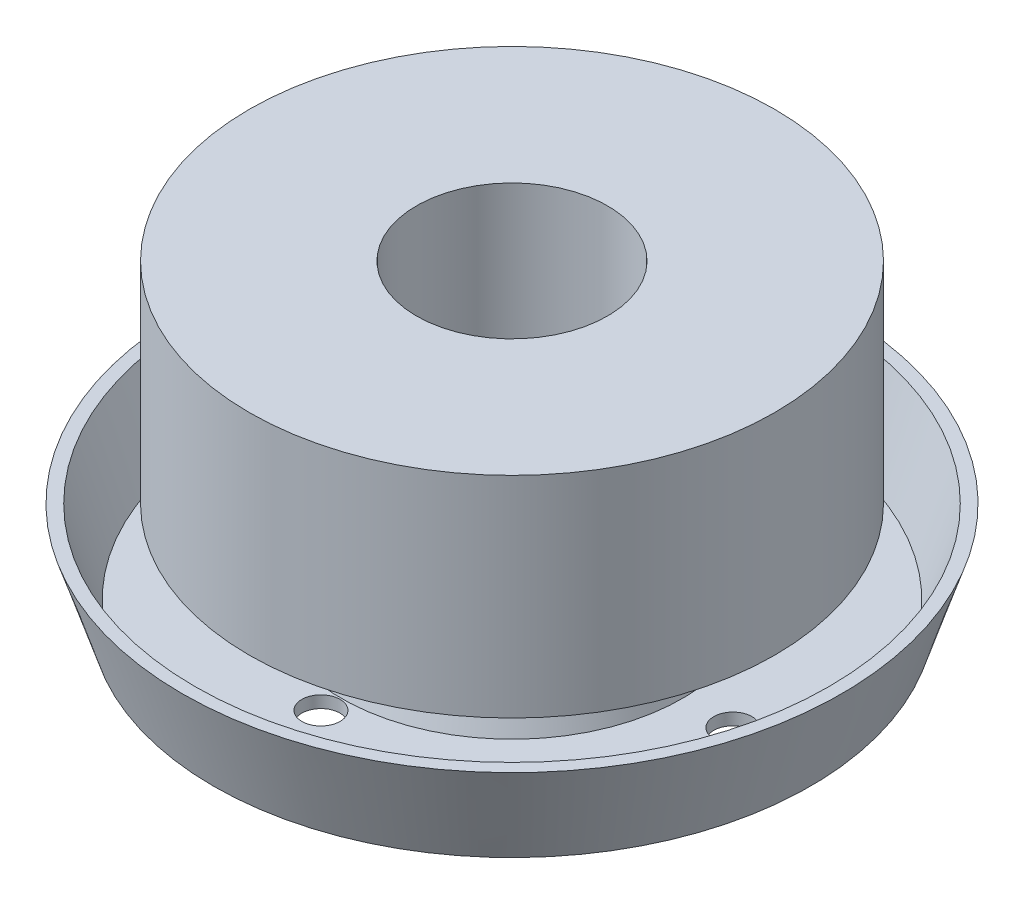
from build123d import *

# Parameters (mm, degrees)
SKETCH2_R                       = 11
SKETCH2_R_2                     = 4
BOSS_EXTRUDE1_DEPTH             = 8.8
M2X0_4_TAPPED_HOLE1_D           = 1.6
M2X0_4_TAPPED_HOLE1_DEPTH       = 0.5
BOSS_EXTRUDE3_START             = 14
BOSS_EXTRUDE3_DEPTH             = 5
BOSS_EXTRUDE3_DIRECTION_2_REACH = 39.339


with BuildPart() as part:
    # Sketch1 → Revolve1 (revolve)
    with BuildSketch(Plane.XY, mode=Mode.PRIVATE) as revolve1_sk:
        Polygon((1.5, 4), (1.5, 0), (12.5, 0), (13.8, 4), (13.274256479, 4), (12.136756479, 0.5), (7.1375, 0.5), (6, 4), align=None)
    revolve(revolve1_sk.sketch.rotate(Axis((0, 0, 0), (0, 1, 0)), 90), axis=Axis((0, 0, 0), (0, 1, 0)))

    # Sketch2 → Boss-Extrude1 (add)
    with BuildSketch(Plane(origin=(0, 4, 0), x_dir=(1, 0, 0), z_dir=(0, 1, 0))):
        with Locations(Location((0, 0, 0), (0, 0, 270))):
            Circle(SKETCH2_R)
        with Locations(Location((0, 0, 0), (0, 0, 270))):
            Circle(SKETCH2_R_2, mode=Mode.SUBTRACT)
    extrude(amount=BOSS_EXTRUDE1_DEPTH)

    # M2x0.4 Tapped Hole1
    with Locations(Plane(origin=(0, 0, 0), x_dir=(-1, 0, 0), z_dir=(0, -1, 0))):
        with Locations((0, 8), (0, -8), (-9.25, 0), (9.25, 0)):
            Hole(M2X0_4_TAPPED_HOLE1_D / 2, depth=M2X0_4_TAPPED_HOLE1_DEPTH)

    # Sketch6 → Boss-Extrude3 (add)
    with BuildSketch(Plane(origin=(0, 0, 0), x_dir=(-0.7071067811865477, 0, 0.7071067811865475), z_dir=(-0.7071067811865475, 0, -0.7071067811865477)).offset(BOSS_EXTRUDE3_START)):
        with BuildLine():
            Line((-1.25, 3.475), (1.25, 3.475))
            ThreePointArc((1.25, 3.475), (1.975, 2.75), (1.25, 2.025))
            Line((1.25, 2.025), (-1.25, 2.025))
            ThreePointArc((-1.25, 2.025), (-1.975, 2.75), (-1.25, 3.475))
        make_face()
    extrude(amount=BOSS_EXTRUDE3_DEPTH)

    # Sketch6 → Boss-Extrude3 direction 2 (add, up to next)
    with BuildSketch(Plane(origin=(0, 0, 0), x_dir=(-0.7071067811865477, 0, 0.7071067811865475), z_dir=(-0.7071067811865475, 0, -0.7071067811865477)).offset(BOSS_EXTRUDE3_START), mode=Mode.PRIVATE) as boss_extrude3_direction_2_sk1:
        with BuildLine():
            Line((-1.25, 3.475), (1.25, 3.475))
            ThreePointArc((1.25, 3.475), (1.975, 2.75), (1.25, 2.025))
            Line((1.25, 2.025), (-1.25, 2.025))
            ThreePointArc((-1.25, 2.025), (-1.975, 2.75), (-1.25, 3.475))
        make_face()
    boss_extrude3_direction_2_tool1 = extrude(boss_extrude3_direction_2_sk1.sketch, amount=-BOSS_EXTRUDE3_DIRECTION_2_REACH, mode=Mode.PRIVATE) - part.part
    add(boss_extrude3_direction_2_tool1.solids().sort_by_distance((-9.899495, 2.75, -9.899495))[0])


solid = part.part
